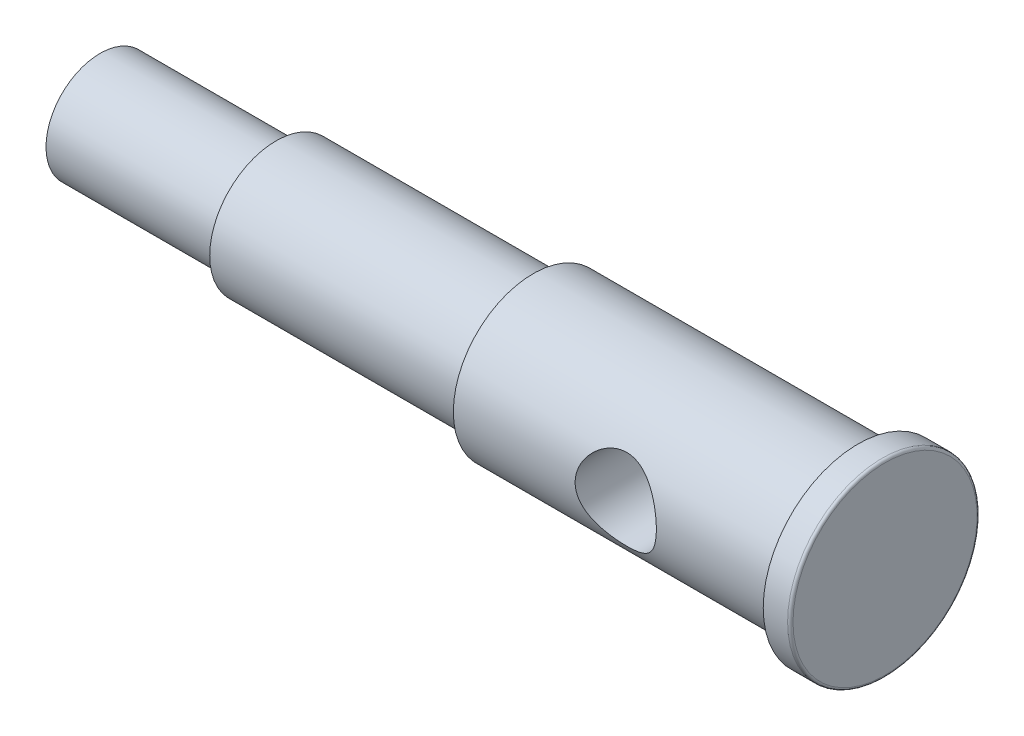
from build123d import *

# Parameters (mm, degrees)
CUT_EXTRUDE1_REACH                  = 31.419
CUT_EXTRUDE1_END_RADIUS             = 2.95
SKETCH2_R                           = 1.5
CUT_EXTRUDE1_DIRECTION_2_REACH      = 31.419
CUT_EXTRUDE1_DIRECTION_2_END_RADIUS = 2.95
FILLET1_R                           = 0.1


with BuildPart() as part:
    # Sketch1 → Revolve1 (revolve)
    with BuildSketch(Plane(origin=(0, 0, 0), x_dir=(1, 0, 0), z_dir=(0, 1, 0)), mode=Mode.PRIVATE) as revolve1_sk:
        Polygon((-29, 0), (0, 0), (0, 3.5), (-1, 3.5), (-1, 2.95), (-13, 2.95), (-13, 2.45), (-22.5, 2.45), (-22.5, 2), (-29, 2), align=None)
    revolve(revolve1_sk.sketch.rotate(Axis((-33.923612536, 0, 0), (1, 0, 0)), 180), axis=Axis((-33.923612536, 0, 0), (1, 0, 0)))

    # Cut-Extrude1: up to this cylinder (the profile starts inside it)
    cut_extrude1_end = Plane(origin=(-7, 0, 0), z_dir=(-1, 0, 0)) * Cylinder(CUT_EXTRUDE1_END_RADIUS, 69.738, mode=Mode.PRIVATE)
    # Sketch2 → Cut-Extrude1 (cut, up to the surface)
    with BuildSketch(Plane.XY, mode=Mode.PRIVATE) as cut_extrude1_sk1:
        with Locations((-7, 0)):
            Circle(SKETCH2_R)
    cut_extrude1_tool1 = extrude(cut_extrude1_sk1.sketch, amount=-CUT_EXTRUDE1_REACH, mode=Mode.PRIVATE) & cut_extrude1_end
    add(cut_extrude1_tool1.solids().sort_by_distance((-7, 0, 0))[0], mode=Mode.SUBTRACT)

    # Cut-Extrude1 direction 2: up to this cylinder (the profile starts inside it)
    cut_extrude1_direction_2_end = Plane(origin=(-7, 0, 0), z_dir=(-1, 0, 0)) * Cylinder(CUT_EXTRUDE1_DIRECTION_2_END_RADIUS, 69.738, mode=Mode.PRIVATE)
    # Sketch2 → Cut-Extrude1 direction 2 (cut, up to the surface)
    with BuildSketch(Plane.XY, mode=Mode.PRIVATE) as cut_extrude1_direction_2_sk1:
        with Locations((-7, 0)):
            Circle(SKETCH2_R)
    cut_extrude1_direction_2_tool1 = extrude(cut_extrude1_direction_2_sk1.sketch, amount=CUT_EXTRUDE1_DIRECTION_2_REACH, mode=Mode.PRIVATE) & cut_extrude1_direction_2_end
    add(cut_extrude1_direction_2_tool1.solids().sort_by_distance((-7, 0, 0))[0], mode=Mode.SUBTRACT)

    # Fillet1
    fillet1_edges = [part.edges().sort_by_distance(p)[0] for p in [
        (0, 0, -3.5),
    ]]
    fillet(fillet1_edges, radius=FILLET1_R)


solid = part.part
